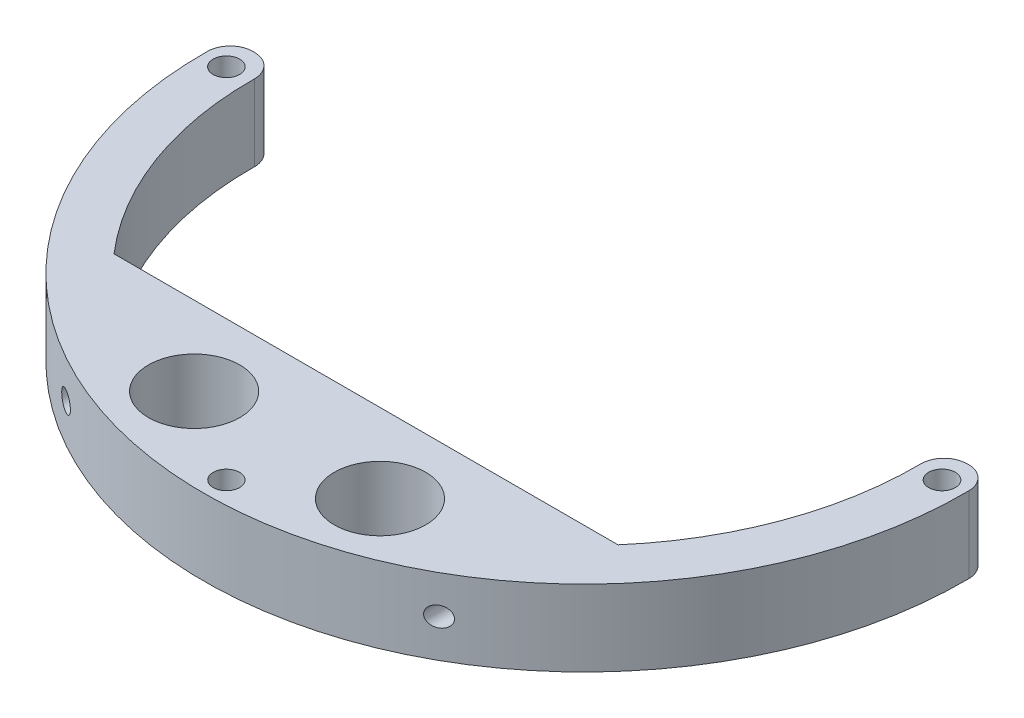
from build123d import *

# Parameters (mm, degrees)
SKETCH1_R           = 1.75
SKETCH1_R_2         = 6
SKETCH1_R_3         = 1.735302394
BOSS_EXTRUDE1_DEPTH = 10
FILLET2_R           = 3
SKETCH2_R           = 1.3
CUT_EXTRUDE1_DEPTH  = 20


with BuildPart() as part:
    # Sketch1 → Boss-Extrude1 (new body)
    with BuildSketch(Plane(origin=(0, 0, 0), x_dir=(1, 0, 0), z_dir=(0, 1, 0))):
        with BuildLine():
            Line((49.859310292, 3.748223209), (43.664405044, 3.223270017))
            ThreePointArc((43.664405044, 3.223270017), (41.560921763, -13.771692694), (33.099549072, -28.659895126))
            Line((33.099549072, -28.659895126), (-33.099549072, -28.659895126))
            ThreePointArc((-33.099549072, -28.659895126), (-41.560921763, -13.771692694), (-43.664405044, 3.223270017))
            Line((-43.664405044, 3.223270017), (-49.859310292, 3.748223209))
            ThreePointArc((-49.859310292, 3.748223209), (0, -50), (49.859310292, 3.748223209))
        make_face()
        with Locations(Location((-47, 0, 0), (0, 0, 270))):
            Circle(SKETCH1_R, mode=Mode.SUBTRACT)
        with Locations(Location((-12.208117153, -39.030992967, 0), (0, 0, 270))):
            Circle(SKETCH1_R_2, mode=Mode.SUBTRACT)
        with Locations(Location((0, -47, 0), (0, 0, 90))):
            Circle(SKETCH1_R_3, mode=Mode.SUBTRACT)
        with Locations(Location((12.208117153, -39.030992967, 0), (0, 0, 90))):
            Circle(SKETCH1_R_2, mode=Mode.SUBTRACT)
        with Locations(Location((47, 0, 0), (0, 0, 90))):
            Circle(SKETCH1_R, mode=Mode.SUBTRACT)
    extrude(amount=BOSS_EXTRUDE1_DEPTH)

    # Fillet2
    fillet2_edges = [part.edges().sort_by_distance(p)[0] for p in [
        (43.664405044, 5, -3.223270017),
        (49.859310292, 5, -3.748223209),
        (-49.859310292, 5, -3.748223209),
        (-43.664405044, 5, -3.223270017),
    ]]
    fillet(fillet2_edges, radius=FILLET2_R)

    # Sketch2 → Cut-Extrude1 (cut)
    with BuildSketch(Plane(origin=(0, 0, 28.659895126), x_dir=(-1, 0, 0), z_dir=(0, 0, -1))):
        with Locations((24.499993487, 5.025263165)):
            Circle(SKETCH2_R)
        with Locations((-24.5, 5)):
            Circle(SKETCH2_R)
    extrude(amount=-CUT_EXTRUDE1_DEPTH, mode=Mode.SUBTRACT)


solid = part.part
